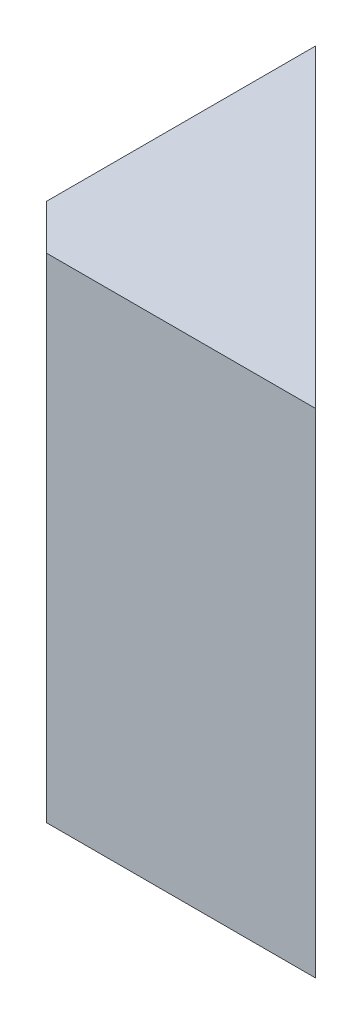
from build123d import *

# Parameters (mm, degrees)
BOSS_EXTRUDE1_DEPTH = 0.55


with BuildPart() as part:
    # Sketch1 → Boss-Extrude1 (new body)
    with BuildSketch(Plane(origin=(0, 0, 0), x_dir=(1, 0, 0), z_dir=(0, 1, 0))):
        Polygon((0, 0), (0, 0.3), (0.35, -0.05), (0.05, -0.05), align=None)
    extrude(amount=BOSS_EXTRUDE1_DEPTH)


solid = part.part
